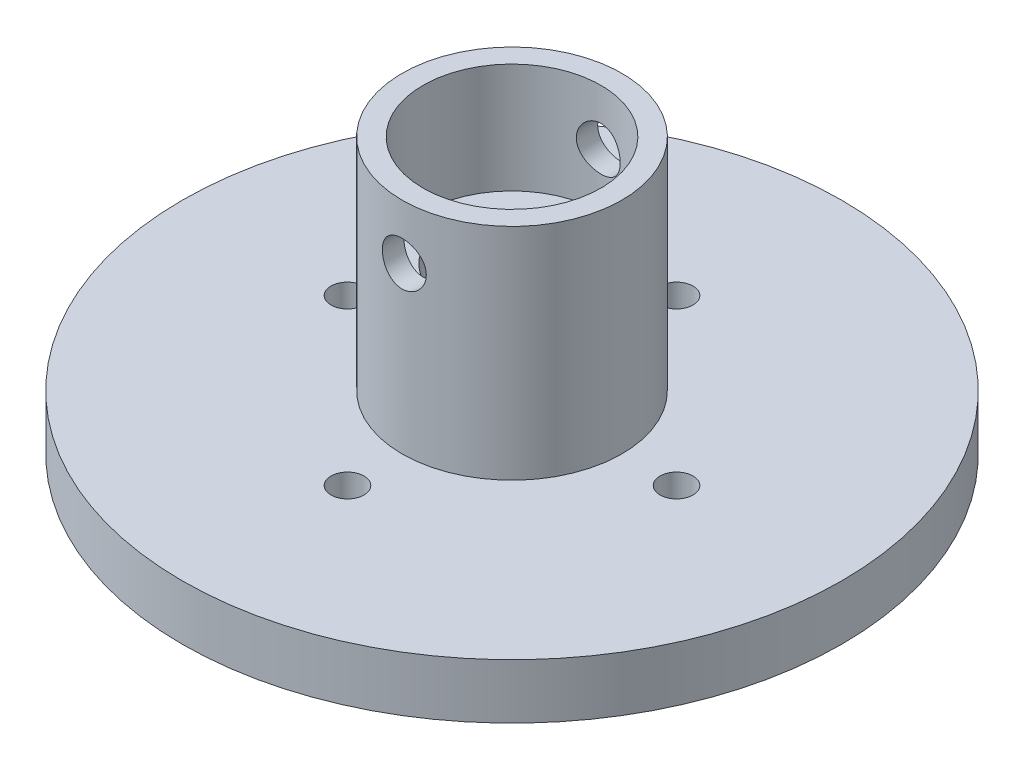
from build123d import *

# Parameters (mm, degrees)
SKETCH1_R           = 30
BOSS_EXTRUDE1_DEPTH = 5
SKETCH2_R           = 10
BOSS_EXTRUDE2_DEPTH = 90
SKETCH4_R           = 6
CUT_EXTRUDE2_DEPTH  = 200
SKETCH5_R           = 1.5
CUT_EXTRUDE3_DEPTH  = 10
SKETCH6_R           = 8
CUT_EXTRUDE4_DEPTH  = 10
SKETCH8_R           = 2
CUT_EXTRUDE5_DEPTH  = 20
CUT_EXTRUDE6_START  = -70
SKETCH10_R          = 10
CUT_EXTRUDE6_DEPTH  = 70
SKETCH12_R          = 8.1
CUT_EXTRUDE7_DEPTH  = 10
SKETCH13_R          = 2
CUT_EXTRUDE8_DEPTH  = 20


with BuildPart() as part:
    # Sketch1 → Boss-Extrude1 (new body)
    with BuildSketch(Plane(origin=(0, 0, 0), x_dir=(1, 0, 0), z_dir=(0, 1, 0))):
        with Locations(Location((0, 0, 0), (0, 0, 270))):
            Circle(SKETCH1_R)
    extrude(amount=BOSS_EXTRUDE1_DEPTH)

    # Sketch2 → Boss-Extrude2 (add)
    with BuildSketch(Plane(origin=(0, 5, 0), x_dir=(1, 0, 0), z_dir=(0, 1, 0))):
        with Locations(Location((0, 0, 0), (0, 0, 90))):
            Circle(SKETCH2_R)
    extrude(amount=BOSS_EXTRUDE2_DEPTH)

    # Sketch4 → Cut-Extrude2 (cut)
    with BuildSketch(Plane(origin=(0, 95, 0), x_dir=(1, 0, 0), z_dir=(0, 1, 0))):
        with Locations(Location((0, 0, 0), (0, 0, 270))):
            Circle(SKETCH4_R)
    extrude(amount=-CUT_EXTRUDE2_DEPTH, mode=Mode.SUBTRACT)

    # Sketch5 → Cut-Extrude3 (cut)
    with BuildSketch(Plane(origin=(0, 5, 0), x_dir=(1, 0, 0), z_dir=(0, 1, 0))):
        with Locations(Location((0, 14.969819474, 0), (0, 0, 270))):
            Circle(SKETCH5_R)
        with Locations(Location((14.969819474, 0, 0), (0, 0, 270))):
            Circle(SKETCH5_R)
        with Locations(Location((0, -14.969819474, 0), (0, 0, 270))):
            Circle(SKETCH5_R)
        with Locations(Location((-14.969819474, 0, 0), (0, 0, 270))):
            Circle(SKETCH5_R)
    extrude(amount=-CUT_EXTRUDE3_DEPTH, mode=Mode.SUBTRACT)

    # Sketch6 → Cut-Extrude4 (cut)
    with BuildSketch(Plane(origin=(0, 95, 0), x_dir=(1, 0, 0), z_dir=(0, 1, 0))):
        with Locations(Location((0, 0, 0), (0, 0, 270))):
            Circle(SKETCH6_R)
    extrude(amount=-CUT_EXTRUDE4_DEPTH, mode=Mode.SUBTRACT)

    # Sketch8 → Cut-Extrude5 (cut)
    with BuildSketch(Plane(origin=(0, 95, -10), x_dir=(-1, 0, 0), z_dir=(0, 0, -1))):
        with Locations((0, -5)):
            Circle(SKETCH8_R)
    extrude(amount=-CUT_EXTRUDE5_DEPTH, mode=Mode.SUBTRACT)

    # Sketch10 → Cut-Extrude6 (cut)
    with BuildSketch(Plane(origin=(0, 95, 0), x_dir=(1, 0, 0), z_dir=(0, 1, 0)).offset(CUT_EXTRUDE6_START)):
        with Locations(Location((0, 0, 0), (0, 0, 90))):
            Circle(SKETCH10_R)
    extrude(amount=CUT_EXTRUDE6_DEPTH, mode=Mode.SUBTRACT)

    # Sketch12 → Cut-Extrude7 (cut)
    with BuildSketch(Plane(origin=(0, 25, 0), x_dir=(1, 0, 0), z_dir=(0, 1, 0))):
        with Locations(Location((0, 0, 0), (0, 0, 270))):
            Circle(SKETCH12_R)
    extrude(amount=-CUT_EXTRUDE7_DEPTH, mode=Mode.SUBTRACT)

    # Sketch13 → Cut-Extrude8 (cut)
    with BuildSketch(Plane(origin=(0, 95, -10), x_dir=(-1, 0, 0), z_dir=(0, 0, -1))):
        with Locations((0, -75)):
            Circle(SKETCH13_R)
    extrude(amount=-CUT_EXTRUDE8_DEPTH, mode=Mode.SUBTRACT)


solid = part.part
